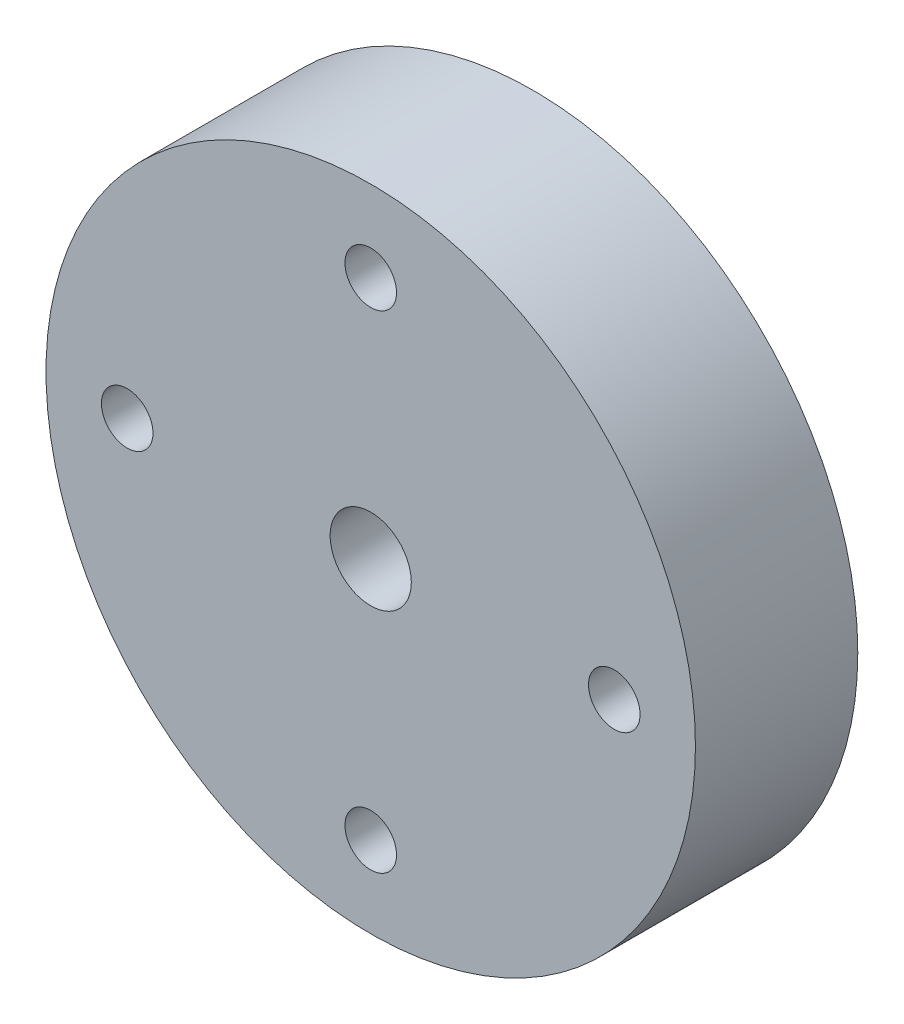
from build123d import *

# Parameters (mm, degrees)
SKETCH3_R                    = 20
SKETCH3_R_2                  = 2.5
BOSS_EXTRUDE2_DEPTH          = 10
F_1_8_0_125_DIAMETER_HOLE2_D = 3.175


with BuildPart() as part:
    # Sketch3 → Boss-Extrude2 (new body)
    with BuildSketch(Plane.XY):
        Circle(SKETCH3_R)
        Circle(SKETCH3_R_2, mode=Mode.SUBTRACT)
    extrude(amount=BOSS_EXTRUDE2_DEPTH)

    # 1/8 (0.125) Diameter Hole2 (through all)
    with Locations(Plane.XY.offset(10)):
        with Locations((0, 15), (15, 0), (0, -15), (-15, 0)):
            Hole(F_1_8_0_125_DIAMETER_HOLE2_D / 2)


solid = part.part
